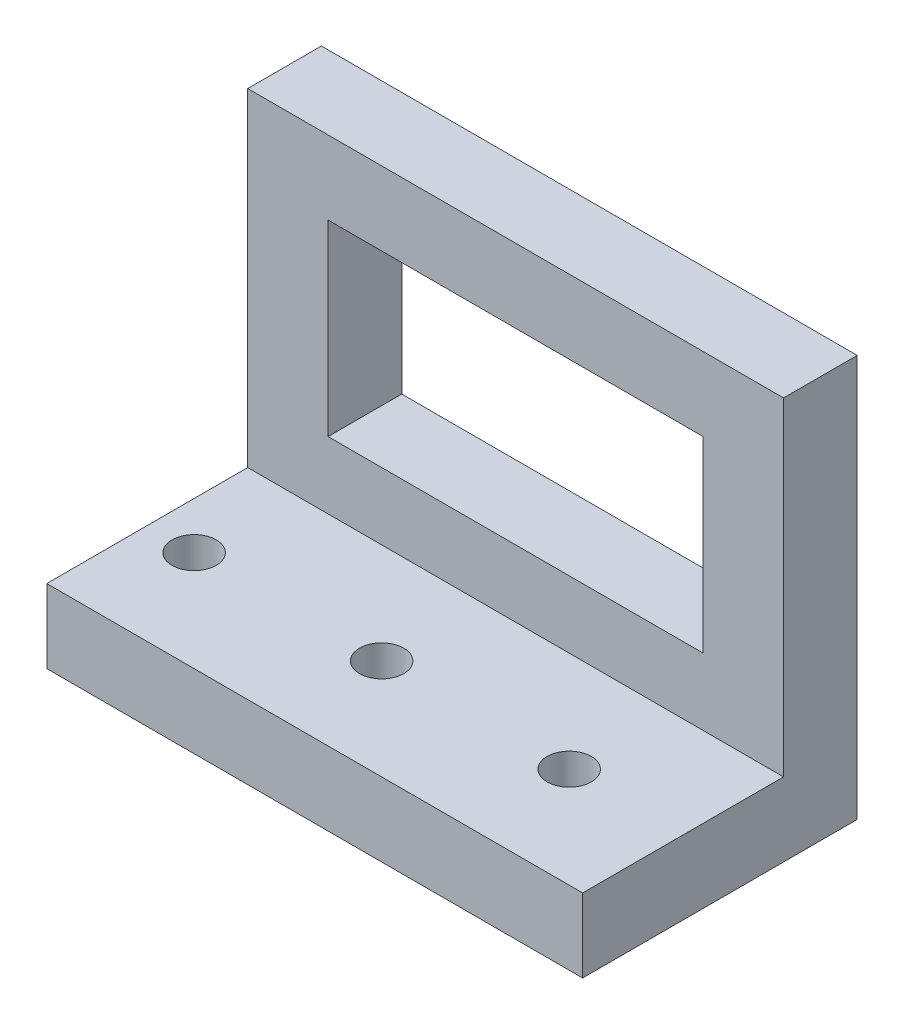
from build123d import *

# Parameters (mm, degrees)
SKETCH1_W           = 40
SKETCH1_H           = 30
BOSS_EXTRUDE1_DEPTH = 5.5
SKETCH4_W           = 28
SKETCH4_H           = 14
CUT_EXTRUDE1_DEPTH  = 5.5
SKETCH5_W           = 40
SKETCH5_H           = 5.5
BOSS_EXTRUDE2_DEPTH = 15
SKETCH6_R           = 1.65
CUT_EXTRUDE3_DEPTH  = 15


with BuildPart() as part:
    # Sketch1 → Boss-Extrude1 (new body)
    with BuildSketch(Plane.XY):
        with Locations((-0.222222222, -4.277777778)):
            Rectangle(SKETCH1_W, SKETCH1_H)
    extrude(amount=BOSS_EXTRUDE1_DEPTH)

    # Sketch4 → Cut-Extrude1 (cut)
    with BuildSketch(Plane.XY.offset(5.5)):
        with Locations((-0.222222222, -1.777777778)):
            Rectangle(SKETCH4_W, SKETCH4_H)
    extrude(amount=-CUT_EXTRUDE1_DEPTH, mode=Mode.SUBTRACT)

    # Sketch5 → Boss-Extrude2 (add)
    with BuildSketch(Plane.XY.offset(5.5)):
        with Locations((-0.222222222, -16.527777778)):
            Rectangle(SKETCH5_W, SKETCH5_H)
    extrude(amount=BOSS_EXTRUDE2_DEPTH)

    # Sketch6 → Cut-Extrude3 (cut)
    with BuildSketch(Plane.XZ.offset(19.277777778)):
        with Locations(Location((-16.722222222, 13, 0), (0, 0, 270))):
            Circle(SKETCH6_R)
        with Locations(Location((-2.722222222, 13, 0), (0, 0, 270))):
            Circle(SKETCH6_R)
        with Locations(Location((11.277777778, 13, 0), (0, 0, 270))):
            Circle(SKETCH6_R)
    extrude(amount=-CUT_EXTRUDE3_DEPTH, mode=Mode.SUBTRACT)


solid = part.part
